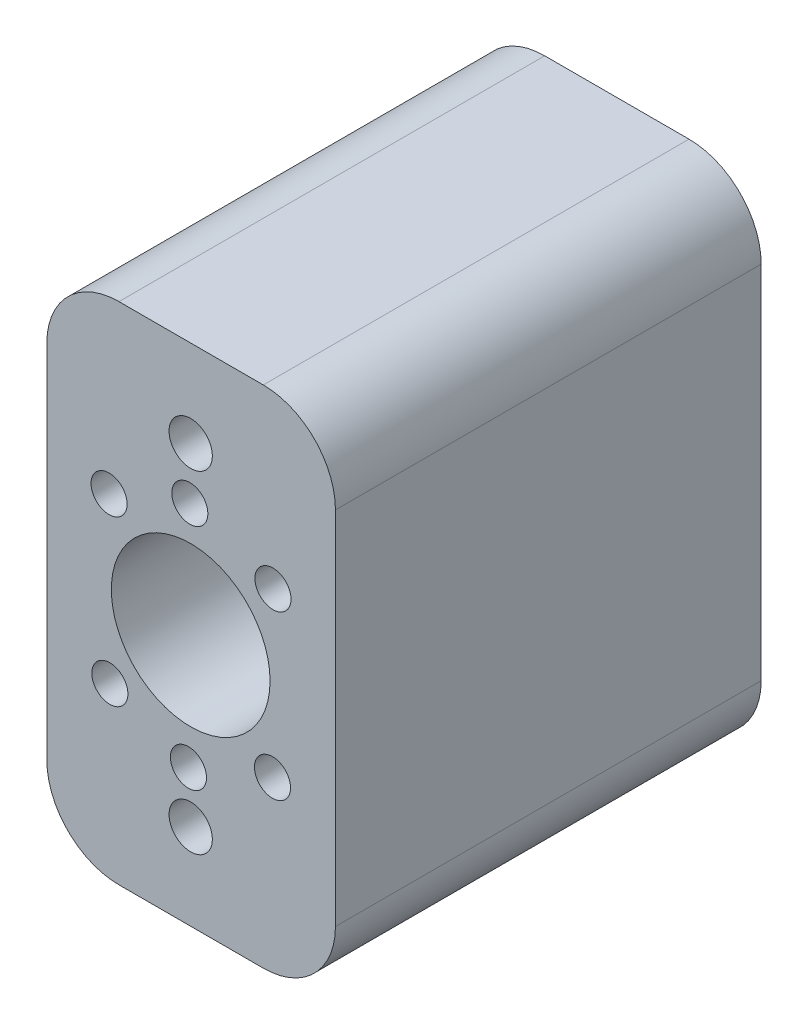
from build123d import *

# Parameters (mm, degrees)
SKETCH1_W                      = 40
SKETCH1_H                      = 70
BOSS_EXTRUDE1_DEPTH            = 59
SKETCH2_R                      = 11
SKETCH2_R_2                    = 2.5
CUT_EXTRUDE1_DEPTH             = 72.504101247
F_2_5_2_5_DIAMETER_HOLE1_D     = 2.5
F_2_5_2_5_DIAMETER_HOLE1_DEPTH = 7.248924226
F_2_5_2_5_DIAMETER_HOLE1_TIP   = 0.751075774
SKETCH5_W                      = 24
SKETCH5_H                      = 6
CUT_EXTRUDE2_DEPTH             = 3
FILLET2_R                      = 10
FILLET3_R                      = 10
FILLET4_R                      = 10
FILLET5_R                      = 10
SKETCH9_R                      = 3
CUT_EXTRUDE3_DEPTH             = 72.504101247


with BuildPart() as part:
    # Sketch1 → Boss-Extrude1 (new body)
    with BuildSketch(Plane.XY):
        with Locations((0.060830656, 0.062794648)):
            Rectangle(SKETCH1_W, SKETCH1_H)
    extrude(amount=BOSS_EXTRUDE1_DEPTH)

    # Sketch2 → Cut-Extrude1 (cut, through all)
    with BuildSketch(Plane.XY):
        Circle(SKETCH2_R)
        with Locations((-11.313708499, 11.313708499)):
            Circle(SKETCH2_R_2)
        with Locations((-0.122338904, 15.759725587)):
            Circle(SKETCH2_R_2)
        with Locations((11.402693442, 11.263696484)):
            Circle(SKETCH2_R_2)
        with Locations((11.339369089, -11.406422087)):
            Circle(SKETCH2_R_2)
        with Locations((-0.312311964, -16.029099896)):
            Circle(SKETCH2_R_2)
        with Locations((-11.204100775, -11.406422087)):
            Circle(SKETCH2_R_2)
    extrude(amount=CUT_EXTRUDE1_DEPTH, mode=Mode.SUBTRACT)

    # Ø2.5 (2.5) Diameter Hole1
    with Locations(Plane.ZY.offset(19.939169344)):
        with Locations((14.5, 15.062794648), (44.5, 15.062794648), (44.5, -14.937205352), (14.5, -14.937205352)):
            Hole(F_2_5_2_5_DIAMETER_HOLE1_D / 2, depth=F_2_5_2_5_DIAMETER_HOLE1_DEPTH)
            with Locations((0, 0, -(F_2_5_2_5_DIAMETER_HOLE1_DEPTH + F_2_5_2_5_DIAMETER_HOLE1_TIP / 2))):  # 118° drill point
                Cone(0, F_2_5_2_5_DIAMETER_HOLE1_D / 2, F_2_5_2_5_DIAMETER_HOLE1_TIP, mode=Mode.SUBTRACT)

    # Sketch5 → Cut-Extrude2 (cut)
    with BuildSketch(Plane.ZY.offset(19.939169344)):
        with Locations((29.5, -14.937205352)):
            Rectangle(SKETCH5_W, SKETCH5_H)
    extrude(amount=-CUT_EXTRUDE2_DEPTH, mode=Mode.SUBTRACT)

    # Fillet2
    fillet2_edges = [part.edges().sort_by_distance(p)[0] for p in [
        (20.060830656, 35.062794648, 29.5),
    ]]
    fillet(fillet2_edges, radius=FILLET2_R)

    # Fillet3
    fillet3_edges = [part.edges().sort_by_distance(p)[0] for p in [
        (-19.939169344, 35.062794648, 29.5),
    ]]
    fillet(fillet3_edges, radius=FILLET3_R)

    # Fillet4
    fillet4_edges = [part.edges().sort_by_distance(p)[0] for p in [
        (20.060830656, -34.937205352, 29.5),
    ]]
    fillet(fillet4_edges, radius=FILLET4_R)

    # Fillet5
    fillet5_edges = [part.edges().sort_by_distance(p)[0] for p in [
        (-19.939169344, -34.937205352, 29.5),
    ]]
    fillet(fillet5_edges, radius=FILLET5_R)

    # Sketch9 → Cut-Extrude3 (cut, through all)
    with BuildSketch(Plane.XY.offset(59)):
        with Locations((0, 23.01)):
            Circle(SKETCH9_R)
        with Locations((0, -23.01)):
            Circle(SKETCH9_R)
    extrude(amount=-CUT_EXTRUDE3_DEPTH, mode=Mode.SUBTRACT)


solid = part.part
